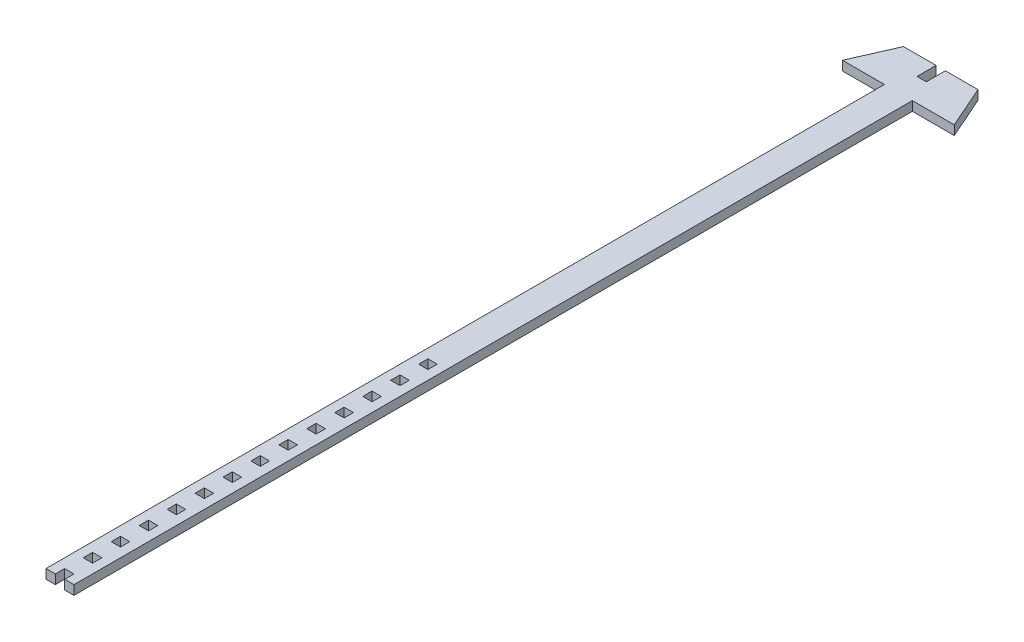
from build123d import *

# Parameters (mm, degrees)
SKETCH_1_W      = 10
SKETCH_1_H      = 10
EXTRUDE_1_DEPTH = 10


with BuildPart() as part:
    # Эскиз1 → Бобышка-Вытянуть1 (new body)
    with BuildSketch(Plane(origin=(0, 0, 0), x_dir=(1, 0, 0), z_dir=(0, 1, 0))):
        Polygon((-60, 0), (-15, 0), (-15, -900), (-5, -900), (-5, -890), (5, -890), (5, -900), (15, -900), (15, 0), (60, 0), (40, 45.461538462), (5, 45.461538462), (5, 25), (-5, 25), (-5, 45.461538462), (-40, 45.461538462), align=None)
        with Locations((0, -865)):
            Rectangle(SKETCH_1_W, SKETCH_1_H, mode=Mode.SUBTRACT)
        with Locations((0, -835)):
            Rectangle(SKETCH_1_W, SKETCH_1_H, mode=Mode.SUBTRACT)
        with Locations((0, -805)):
            Rectangle(SKETCH_1_W, SKETCH_1_H, mode=Mode.SUBTRACT)
        with Locations((0, -775)):
            Rectangle(SKETCH_1_W, SKETCH_1_H, mode=Mode.SUBTRACT)
        with Locations((0, -745)):
            Rectangle(SKETCH_1_W, SKETCH_1_H, mode=Mode.SUBTRACT)
        with Locations((0, -715)):
            Rectangle(SKETCH_1_W, SKETCH_1_H, mode=Mode.SUBTRACT)
        with Locations((0, -685)):
            Rectangle(SKETCH_1_W, SKETCH_1_H, mode=Mode.SUBTRACT)
        with Locations((0, -655)):
            Rectangle(SKETCH_1_W, SKETCH_1_H, mode=Mode.SUBTRACT)
        with Locations((0, -625)):
            Rectangle(SKETCH_1_W, SKETCH_1_H, mode=Mode.SUBTRACT)
        with Locations((0, -595)):
            Rectangle(SKETCH_1_W, SKETCH_1_H, mode=Mode.SUBTRACT)
        with Locations((0, -565)):
            Rectangle(SKETCH_1_W, SKETCH_1_H, mode=Mode.SUBTRACT)
        with Locations((0, -535)):
            Rectangle(SKETCH_1_W, SKETCH_1_H, mode=Mode.SUBTRACT)
        with Locations((0, -505)):
            Rectangle(SKETCH_1_W, SKETCH_1_H, mode=Mode.SUBTRACT)
    extrude(amount=EXTRUDE_1_DEPTH)


solid = part.part
